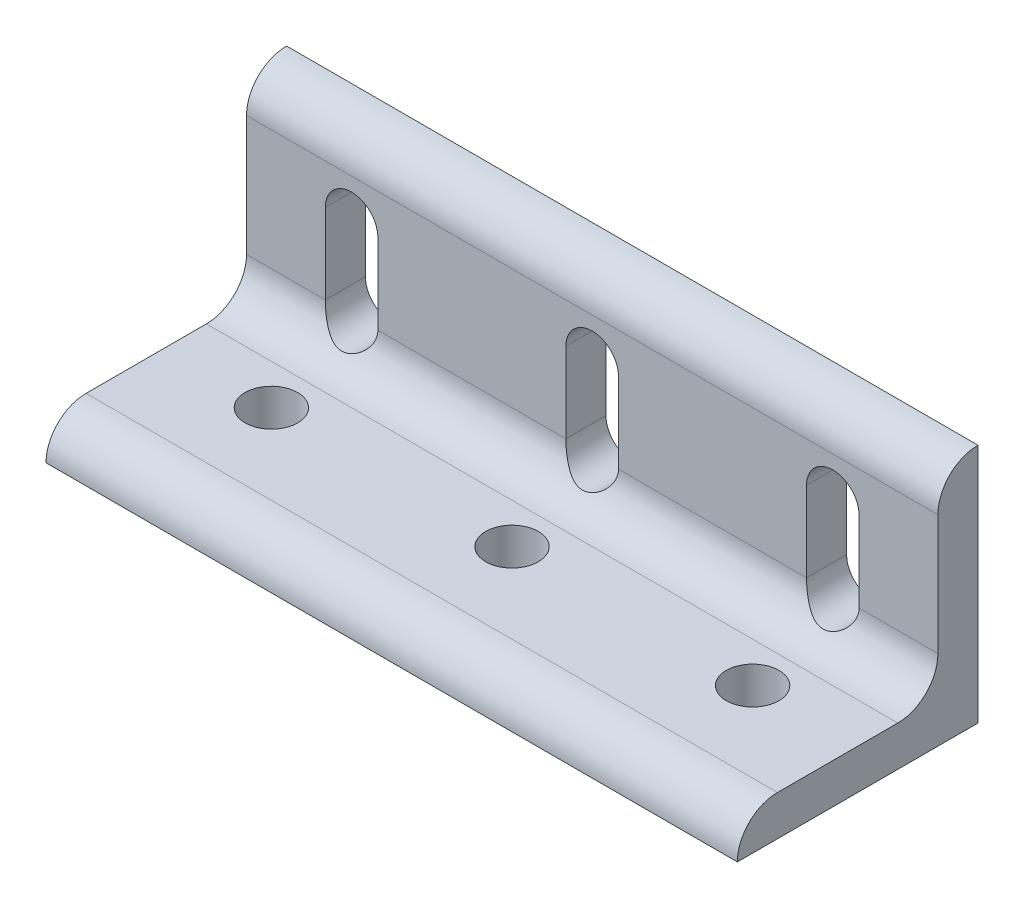
from build123d import *

# Parameters (mm, degrees)
BASE_EXTRUDE_DEPTH = 54.737
SKETCH2_R          = 4.1656
HOLE_DEPTH         = 77.807285911
HOLE_PATTERN_COUNT = 3
HOLE_PATTERN_PITCH = 38.1
SLOT_DEPTH         = 77.807285911
SLOT_PATTERN_COUNT = 3
SLOT_PATTERN_PITCH = 38.1


with BuildPart() as part:
    # Sketch1 → Base Extrude (new, symmetric)
    with BuildSketch(Plane(origin=(0, 0, 0), x_dir=(0, 0, -1), z_dir=(1, 0, 0))):
        with BuildLine():
            Line((-6.35, 12.7), (-6.35, 31.75))
            ThreePointArc((-6.35, 31.75), (-4.490128061, 36.240128061), (0, 38.1))
            Line((0, 38.1), (0, 0))
            Line((0, 0), (-38.1, 0))
            ThreePointArc((-38.1, 0), (-36.240128061, 4.490128061), (-31.75, 6.35))
            Line((-31.75, 6.35), (-12.7, 6.35))
            ThreePointArc((-12.7, 6.35), (-8.209871939, 8.209871939), (-6.35, 12.7))
        make_face()
    extrude(amount=BASE_EXTRUDE_DEPTH, both=True)

    # Sketch2 → Hole (cut, through all)
    with BuildSketch(Plane.XZ):
        with Locations(Location((-38.1, 19.05, 0), (0, 0, 270))):
            Circle(SKETCH2_R)
    hole = extrude(amount=-HOLE_DEPTH, mode=Mode.SUBTRACT)

    # Hole Pattern: Hole ×3
    with Locations(*[(i * HOLE_PATTERN_PITCH, 0, 0) for i in range(1, HOLE_PATTERN_COUNT)]):
        add(hole, mode=Mode.SUBTRACT)

    # Sketch3 → Slot (cut, through all)
    with BuildSketch(Plane(origin=(0, 0, 0), x_dir=(-1, 0, 0), z_dir=(0, 0, -1))):
        with BuildLine():
            Line((42.2656, 25.4), (42.2656, 12.7))
            ThreePointArc((42.2656, 12.7), (38.1, 8.5344), (33.9344, 12.7))
            Line((33.9344, 12.7), (33.9344, 25.4))
            ThreePointArc((33.9344, 25.4), (38.1, 29.5656), (42.2656, 25.4))
        make_face()
    slot = extrude(amount=-SLOT_DEPTH, mode=Mode.SUBTRACT)

    # Slot Pattern: Slot ×3
    with Locations(*[(i * SLOT_PATTERN_PITCH, 0, 0) for i in range(1, SLOT_PATTERN_COUNT)]):
        add(slot, mode=Mode.SUBTRACT)


solid = part.part
